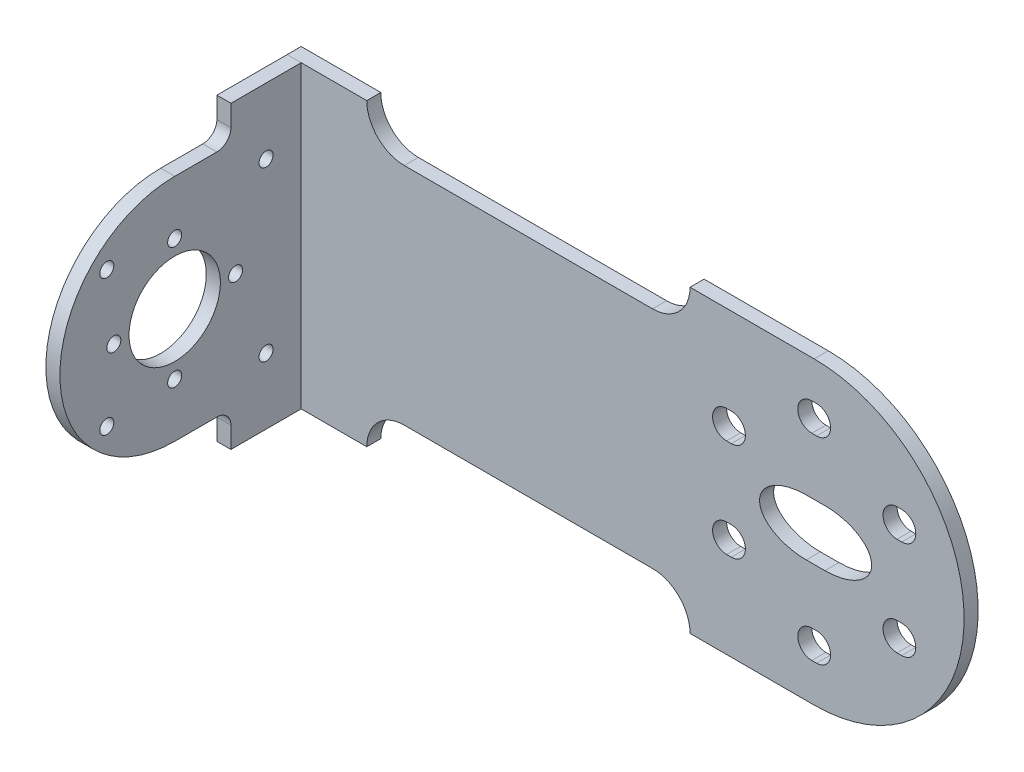
from build123d import *

# Parameters (mm, degrees)
BOSS_EXTRUDE1_DEPTH = 3
SKETCH2_R           = 1.5
BOSS_EXTRUDE2_DEPTH = 3
SKETCH3_R           = 6
CUT_EXTRUDE1_DEPTH  = 150.495916109
CUT_EXTRUDE2_DEPTH  = 128.79866979
CUT_EXTRUDE3_DEPTH  = 128.798669903


with BuildPart() as part:
    # Sketch1 → Boss-Extrude1 (new body)
    with BuildSketch(Plane.XY):
        with BuildLine():
            Line((-112.5, 32), (0, 32))
            ThreePointArc((0, 32), (32, 0), (0, -32))
            Line((0, -32), (-112.5, -32))
            Line((-112.5, -32), (-112.5, 32))
        make_face()
        with BuildLine():
            Line((17.686533479, 13.5), (18.686533479, 13.5))
            ThreePointArc((18.686533479, 13.5), (21.686533479, 10.5), (18.686533479, 7.5))
            Line((18.686533479, 7.5), (17.686533479, 7.5))
            ThreePointArc((17.686533479, 7.5), (14.686533479, 10.5), (17.686533479, 13.5))
        make_face(mode=Mode.SUBTRACT)
        with BuildLine():
            Line((17.686533479, -7.5), (18.686533479, -7.5))
            ThreePointArc((18.686533479, -7.5), (21.686533479, -10.5), (18.686533479, -13.5))
            Line((18.686533479, -13.5), (17.686533479, -13.5))
            ThreePointArc((17.686533479, -13.5), (14.686533479, -10.5), (17.686533479, -7.5))
        make_face(mode=Mode.SUBTRACT)
        with BuildLine():
            Line((-0.5, -18), (0.5, -18))
            ThreePointArc((0.5, -18), (3.5, -21), (0.5, -24))
            Line((0.5, -24), (-0.5, -24))
            ThreePointArc((-0.5, -24), (-3.5, -21), (-0.5, -18))
        make_face(mode=Mode.SUBTRACT)
        with BuildLine():
            Line((-18.686533479, -7.5), (-17.686533479, -7.5))
            ThreePointArc((-17.686533479, -7.5), (-14.686533479, -10.5), (-17.686533479, -13.5))
            Line((-17.686533479, -13.5), (-18.686533479, -13.5))
            ThreePointArc((-18.686533479, -13.5), (-21.686533479, -10.5), (-18.686533479, -7.5))
        make_face(mode=Mode.SUBTRACT)
        with BuildLine():
            Line((-17.686533479, 7.5), (-18.686533479, 7.5))
            ThreePointArc((-18.686533479, 7.5), (-21.686533479, 10.5), (-18.686533479, 13.5))
            Line((-18.686533479, 13.5), (-17.686533479, 13.5))
            ThreePointArc((-17.686533479, 13.5), (-14.686533479, 10.5), (-17.686533479, 7.5))
        make_face(mode=Mode.SUBTRACT)
        with BuildLine():
            Line((0.5, 18), (-0.5, 18))
            ThreePointArc((-0.5, 18), (-3.5, 21), (-0.5, 24))
            Line((-0.5, 24), (0.5, 24))
            ThreePointArc((0.5, 24), (3.5, 21), (0.5, 18))
        make_face(mode=Mode.SUBTRACT)
    extrude(amount=BOSS_EXTRUDE1_DEPTH)

    # Sketch3 → Cut-Extrude1 (cut, through all)
    with BuildSketch(Plane(origin=(-68.399252687, 0, -51.542533886), x_dir=(0, 1, 0), z_dir=(0.798635510047294, 0, 0.6018150231520466))):
        with Locations(Location((0, 1.0136449, 0), (0, 0, 90))):
            Circle(SKETCH3_R)
    extrude(amount=CUT_EXTRUDE1_DEPTH, mode=Mode.SUBTRACT)

    # Sketch4 → Cut-Extrude2 (cut, through all)
    with BuildSketch(Plane.XY.offset(3)):
        with BuildLine():
            Line((2.296821411, -6), (-1.684313054, -6))
            add(Edge.make_bspline(
                [(-1.684313054, 6), (-11.654153901, 6), (-11.654153901, 0), (-11.654153901, -6), (-1.684313054, -6)],
                knots=[4.71238898, 4.71238898, 4.71238898, 6.283185307, 6.283185307, 7.853981634, 7.853981634, 7.853981634], degree=2, weights=[1, 0.707106781, 1, 0.707106781, 1]))
            Line((-1.684313054, 6), (2.296821411, 6))
            add(Edge.make_bspline(
                [(2.296821411, -6), (12.266662258, -6), (12.266662258, 0), (12.266662258, 6), (2.296821411, 6)],
                knots=[4.71238898, 4.71238898, 4.71238898, 6.283185307, 6.283185307, 7.853981634, 7.853981634, 7.853981634], degree=2, weights=[1, 0.707106781, 1, 0.707106781, 1]))
        make_face()
    extrude(amount=-CUT_EXTRUDE2_DEPTH, mode=Mode.SUBTRACT)

    # Sketch5 → Cut-Extrude3 (cut, through all)
    with BuildSketch(Plane.XY.offset(3)):
        with BuildLine():
            Line((-34.5, 24), (-87.5, 24))
            ThreePointArc((-87.5, 24), (-95.5, 32), (-87.5, 40))
            Line((-87.5, 40), (-34.5, 40))
            ThreePointArc((-34.5, 40), (-26.5, 32), (-34.5, 24))
        make_face()
        with BuildLine():
            Line((-34.5, -24), (-87.5, -24))
            ThreePointArc((-87.5, -24), (-95.5, -32), (-87.5, -40))
            Line((-87.5, -40), (-34.5, -40))
            ThreePointArc((-34.5, -40), (-26.5, -32), (-34.5, -24))
        make_face()
    extrude(amount=-CUT_EXTRUDE3_DEPTH, mode=Mode.SUBTRACT)


with BuildPart() as body_2:
    # Sketch2 → Boss-Extrude2 (new body)
    # profile 1 of 2: a face of its own
    with BuildSketch(Plane.ZY.offset(112.5)):
        with BuildLine():
            Line((3, 0), (3, -32))
            Line((3, -32), (18, -32))
            Line((18, -32), (18, -27.5))
            ThreePointArc((18, -27.5), (18.878679656, -25.378679656), (21, -24.5))
            Line((21, -24.5), (30, -24.5))
            ThreePointArc((30, -24.5), (54.5, 0), (30, 24.5))
            Line((30, 24.5), (21, 24.5))
            ThreePointArc((21, 24.5), (18.878679656, 25.378679656), (18, 27.5))
            Line((18, 27.5), (18, 32))
            Line((18, 32), (3, 32))
            Line((3, 32), (3, 0))
        make_face()
        with Locations((10.5, -17.944358445)):
            Circle(SKETCH2_R, mode=Mode.SUBTRACT)
        with BuildLine():
            ThreePointArc((18.5, 0), (17, -1.5), (15.5, 0))
            ThreePointArc((15.5, 0), (17, 1.5), (18.5, 0))
        make_face(mode=Mode.SUBTRACT)
        with Locations((30, -13)):
            Circle(SKETCH2_R, mode=Mode.SUBTRACT)
        with Locations((44.495689014, -14.495689014)):
            Circle(SKETCH2_R, mode=Mode.SUBTRACT)
        with Locations((10.5, 17.944358445)):
            Circle(SKETCH2_R, mode=Mode.SUBTRACT)
        with BuildLine():
            ThreePointArc((39.75, 0), (30, -9.75), (20.25, 0))
            ThreePointArc((20.25, 0), (30, 9.75), (39.75, 0))
        make_face(mode=Mode.SUBTRACT)
        with Locations((30, 13)):
            Circle(SKETCH2_R, mode=Mode.SUBTRACT)
        with BuildLine():
            ThreePointArc((44.5, 0), (43, -1.5), (41.5, 0))
            ThreePointArc((41.5, 0), (43, 1.5), (44.5, 0))
        make_face(mode=Mode.SUBTRACT)
        with Locations((44.495689014, 14.495689014)):
            Circle(SKETCH2_R, mode=Mode.SUBTRACT)
    # profile 2 of 2: a face of its own
    with BuildSketch(Plane.ZY.offset(112.5)):
        with BuildLine():
            Line((3, 0), (3, -32))
            Line((3, -32), (18, -32))
            Line((18, -32), (18, -27.5))
            ThreePointArc((18, -27.5), (18.878679656, -25.378679656), (21, -24.5))
            Line((21, -24.5), (30, -24.5))
            ThreePointArc((30, -24.5), (54.5, 0), (30, 24.5))
            Line((30, 24.5), (21, 24.5))
            ThreePointArc((21, 24.5), (18.878679656, 25.378679656), (18, 27.5))
            Line((18, 27.5), (18, 32))
            Line((18, 32), (3, 32))
            Line((3, 32), (3, 0))
        make_face()
        with Locations((10.5, -17.944358445)):
            Circle(SKETCH2_R, mode=Mode.SUBTRACT)
        with BuildLine():
            ThreePointArc((18.5, 0), (17, -1.5), (15.5, 0))
            ThreePointArc((15.5, 0), (17, 1.5), (18.5, 0))
        make_face(mode=Mode.SUBTRACT)
        with Locations((30, -13)):
            Circle(SKETCH2_R, mode=Mode.SUBTRACT)
        with Locations((44.495689014, -14.495689014)):
            Circle(SKETCH2_R, mode=Mode.SUBTRACT)
        with Locations((10.5, 17.944358445)):
            Circle(SKETCH2_R, mode=Mode.SUBTRACT)
        with BuildLine():
            ThreePointArc((39.75, 0), (30, -9.75), (20.25, 0))
            ThreePointArc((20.25, 0), (30, 9.75), (39.75, 0))
        make_face(mode=Mode.SUBTRACT)
        with Locations((30, 13)):
            Circle(SKETCH2_R, mode=Mode.SUBTRACT)
        with BuildLine():
            ThreePointArc((44.5, 0), (43, -1.5), (41.5, 0))
            ThreePointArc((41.5, 0), (43, 1.5), (44.5, 0))
        make_face(mode=Mode.SUBTRACT)
        with Locations((44.495689014, 14.495689014)):
            Circle(SKETCH2_R, mode=Mode.SUBTRACT)
    extrude(amount=-BOSS_EXTRUDE2_DEPTH)


solid = Compound([part.part, body_2.part])
